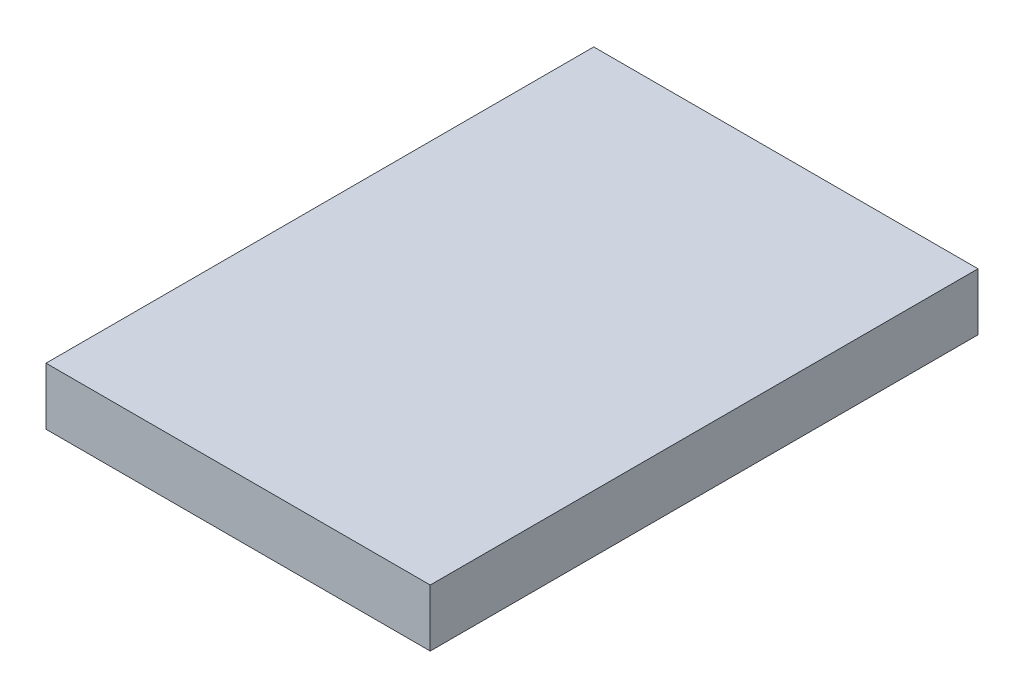
from build123d import *

# Parameters (mm, degrees)
SKETCH1_W           = 74.6125
SKETCH1_H           = 106.3625
BOSS_EXTRUDE1_DEPTH = 11.1125


with BuildPart() as part:
    # Sketch1 → Boss-Extrude1 (new body)
    with BuildSketch(Plane(origin=(0, 0, 0), x_dir=(1, 0, 0), z_dir=(0, 1, 0))):
        with Locations((37.30625, 53.18125)):
            Rectangle(SKETCH1_W, SKETCH1_H)
    extrude(amount=BOSS_EXTRUDE1_DEPTH)


solid = part.part
